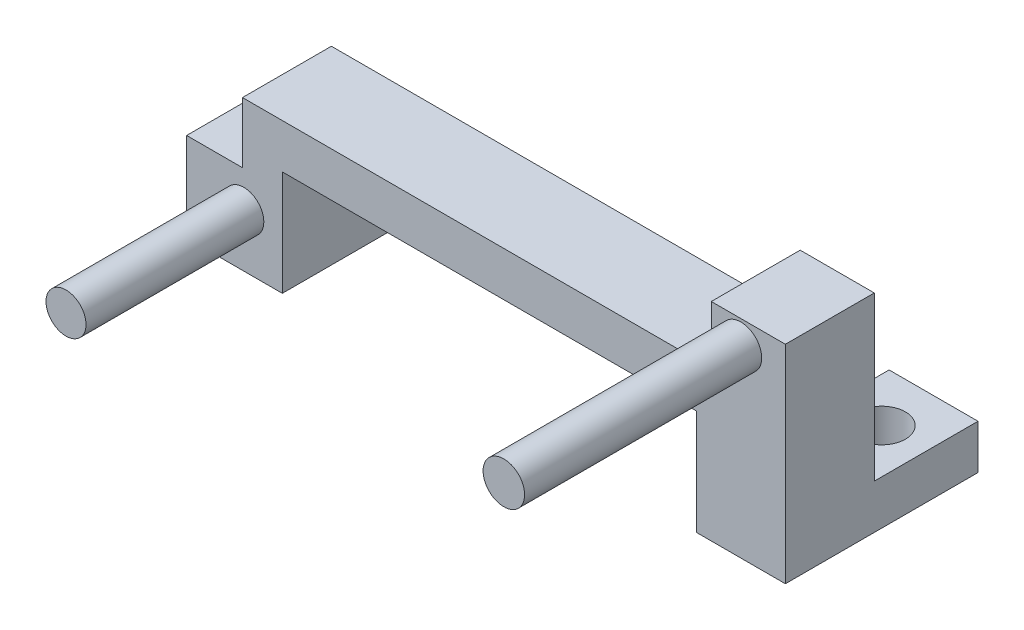
from build123d import *

# Parameters (mm, degrees)
SKETCH1_W            = 4
SKETCH1_H            = 14
BOSS_EXTRUDE1_DEPTH  = 3
SKETCH2_R            = 1.4
BOSS_EXTRUDE2_DEPTH  = 16
SKETCH3_W            = 4
SKETCH3_H            = 1
BOSS_EXTRUDE4_DEPTH  = 6
SKETCH7_W            = 3
SKETCH7_H            = 2
BOSS_EXTRUDE5_DEPTH  = 30.95
SKETCH8_W            = 3
SKETCH8_H            = 2
BOSS_EXTRUDE6_DEPTH  = 1
SKETCH9_W            = 1
SKETCH9_H            = 2
BOSS_EXTRUDE7_DEPTH  = 3
SKETCH10_W           = 1
SKETCH10_H           = 2
BOSS_EXTRUDE8_DEPTH  = 5.92
SKETCH11_W           = 1
SKETCH11_H           = 2
BOSS_EXTRUDE9_DEPTH  = 4
SKETCH12_W           = 1
SKETCH12_H           = 3
BOSS_EXTRUDE14_DEPTH = 0.93
SKETCH13_W           = 3
SKETCH13_H           = 3
BOSS_EXTRUDE15_DEPTH = 7.1
SKETCH14_W           = 3.33402541
SKETCH14_H           = 13.860919233
CUT_EXTRUDE3_DEPTH   = 10
SKETCH15_W           = 6.20666024
SKETCH15_H           = 3.660501205
CUT_EXTRUDE4_DEPTH   = 10
SKETCH16_W           = 3
SKETCH16_H           = 9.1
BOSS_EXTRUDE16_DEPTH = 0.12
SKETCH18_W           = 3
SKETCH18_H           = 9.1
BOSS_EXTRUDE18_DEPTH = 0.41
SKETCH19_W           = 3
SKETCH19_H           = 9.1
BOSS_EXTRUDE19_DEPTH = 0.89
SKETCH20_W           = 3
SKETCH20_H           = 6
BOSS_EXTRUDE20_DEPTH = 3.77
SKETCH21_R           = 1.35
BOSS_EXTRUDE23_DEPTH = 12
BOSS_EXTRUDE24_DEPTH = 3
SKETCH24_W           = 4
SKETCH24_H           = 1
BOSS_EXTRUDE25_DEPTH = 4
SKETCH25_W           = 4
SKETCH25_H           = 7
BOSS_EXTRUDE26_DEPTH = 2
SKETCH26_W           = 6.458993184
SKETCH26_H           = 3
BOSS_EXTRUDE27_DEPTH = 7
SKETCH27_R           = 1.6
CUT_EXTRUDE5_DEPTH   = 7
SKETCH28_R           = 1.6
CUT_EXTRUDE6_DEPTH   = 7
SKETCH30_W           = 7
SKETCH30_H           = 3
BOSS_EXTRUDE29_DEPTH = 1
SKETCH31_W           = 7
SKETCH31_H           = 3
BOSS_EXTRUDE30_DEPTH = 1
SKETCH32_W           = 6
SKETCH32_H           = 7.1
BOSS_EXTRUDE31_DEPTH = 1
SKETCH33_W           = 31.638993184
SKETCH33_H           = 6
BOSS_EXTRUDE32_DEPTH = 1
SKETCH34_W           = 6
SKETCH34_H           = 14
BOSS_EXTRUDE33_DEPTH = 1


with BuildPart() as part:
    # Sketch1 → Boss-Extrude1 (new body)
    with BuildSketch(Plane.XY):
        with Locations((-1.434146341, -3.597560976)):
            Rectangle(SKETCH1_W, SKETCH1_H)
    extrude(amount=BOSS_EXTRUDE1_DEPTH)

    # Sketch2 → Boss-Extrude2 (add)
    with BuildSketch(Plane(origin=(0, 0, 0), x_dir=(-1, 0, 0), z_dir=(0, 0, -1))):
        with Locations(Location((1.434146341, 1.802439024, 0), (0, 0, 180))):
            Circle(SKETCH2_R)
    extrude(amount=BOSS_EXTRUDE2_DEPTH)

    # Sketch3 → Boss-Extrude4 (add)
    with BuildSketch(Plane.XY.offset(3)):
        with Locations((-1.434146341, -10.097560976)):
            Rectangle(SKETCH3_W, SKETCH3_H)
    extrude(amount=BOSS_EXTRUDE4_DEPTH)

    # Sketch7 → Boss-Extrude5 (add)
    with BuildSketch(Plane.ZY.offset(3.434146341)):
        with Locations((1.5, -2.497560976)):
            Rectangle(SKETCH7_W, SKETCH7_H)
    extrude(amount=BOSS_EXTRUDE5_DEPTH)

    # Sketch8 → Boss-Extrude6 (add)
    with BuildSketch(Plane.ZY.offset(34.384146341)):
        with Locations((1.5, -2.497560976)):
            Rectangle(SKETCH8_W, SKETCH8_H)
    extrude(amount=BOSS_EXTRUDE6_DEPTH)

    # Sketch9 → Boss-Extrude7 (add)
    with BuildSketch(Plane(origin=(0, 0, 0), x_dir=(-1, 0, 0), z_dir=(0, 0, -1))):
        with Locations((34.884146341, -2.497560976)):
            Rectangle(SKETCH9_W, SKETCH9_H)
    extrude(amount=BOSS_EXTRUDE7_DEPTH)

    # Sketch10 → Boss-Extrude8 (add)
    with BuildSketch(Plane(origin=(0, 0, -3), x_dir=(-1, 0, 0), z_dir=(0, 0, -1))):
        with Locations((34.884146341, -2.497560976)):
            Rectangle(SKETCH10_W, SKETCH10_H)
    extrude(amount=BOSS_EXTRUDE8_DEPTH)

    # Sketch11 → Boss-Extrude9 (add)
    with BuildSketch(Plane(origin=(0, 0, -8.92), x_dir=(-1, 0, 0), z_dir=(0, 0, -1))):
        with Locations((34.884146341, -2.497560976)):
            Rectangle(SKETCH11_W, SKETCH11_H)
    extrude(amount=BOSS_EXTRUDE9_DEPTH)

    # Sketch12 → Boss-Extrude14 (add)
    with BuildSketch(Plane.XZ.offset(3.497560976)):
        with Locations((-34.884146341, -9.28)):
            Rectangle(SKETCH12_W, SKETCH12_H)
    extrude(amount=BOSS_EXTRUDE14_DEPTH)

    # Sketch13 → Boss-Extrude15 (add)
    with BuildSketch(Plane.XZ.offset(3.497560976)):
        with Locations((-33.884146341, 1.5)):
            Rectangle(SKETCH13_W, SKETCH13_H)
    extrude(amount=BOSS_EXTRUDE15_DEPTH)

    # Sketch14 → Cut-Extrude3 (cut)
    with BuildSketch(Plane.XY.offset(3)):
        with Locations((-35.32015223, -3.66710136)):
            Rectangle(SKETCH14_W, SKETCH14_H)
    extrude(amount=-CUT_EXTRUDE3_DEPTH, mode=Mode.SUBTRACT)


with BuildPart() as cut_extrude3_piece_1:
    # of the separate pieces the step leaves, piece 1, a body of its own (cut_extrude3_pieces)
    add(part.part.solids().sort_by_distance((-3.434146341, 3.402439024, 0))[0])

    # Sketch16 → Boss-Extrude16 (add)
    with BuildSketch(Plane.ZY.offset(33.653139525)):
        with Locations((1.5, -6.047560976)):
            Rectangle(SKETCH16_W, SKETCH16_H)
    extrude(amount=BOSS_EXTRUDE16_DEPTH)

    # Sketch18 → Boss-Extrude18 (add)
    with BuildSketch(Plane.ZY.offset(33.773139525)):
        with Locations((1.5, -6.047560976)):
            Rectangle(SKETCH18_W, SKETCH18_H)
    extrude(amount=BOSS_EXTRUDE18_DEPTH)

    # Sketch19 → Boss-Extrude19 (add)
    with BuildSketch(Plane.ZY.offset(34.183139525)):
        with Locations((1.5, -6.047560976)):
            Rectangle(SKETCH19_W, SKETCH19_H)
    extrude(amount=BOSS_EXTRUDE19_DEPTH)

    # Sketch20 → Boss-Extrude20 (add)
    with BuildSketch(Plane.ZY.offset(35.073139525)):
        with Locations((1.5, -7.597560976)):
            Rectangle(SKETCH20_W, SKETCH20_H)
    extrude(amount=BOSS_EXTRUDE20_DEPTH)

    # Sketch21 → Boss-Extrude23 (add)
    with BuildSketch(Plane(origin=(0, 0, 0), x_dir=(-1, 0, 0), z_dir=(0, 0, -1))):
        with Locations(Location((34.984146341, -7.047560976, 0), (0, 0, 180))):
            Circle(SKETCH21_R)
    extrude(amount=BOSS_EXTRUDE23_DEPTH)

    # Sketch23 → Boss-Extrude24 (add)
    with BuildSketch(Plane.XY.offset(3)):
        Polygon((-38.843139525, -10.597560976), (-38.843139525, -4.597560976), (-35.073139525, -4.597560976), (-35.073139525, -1.497560976), (-3.434146341, -1.497560976), (-3.434146341, 3.402439024), (0.565853659, 3.402439024), (0.565853659, -9.597560976), (-3.434146341, -9.597560976), (-3.434146341, -3.497560976), (-32.384146341, -3.497560976), (-32.384146341, -10.597560976), align=None)
    extrude(amount=BOSS_EXTRUDE24_DEPTH)

    # Sketch24 → Boss-Extrude25 (add)
    with BuildSketch(Plane.XY.offset(9)):
        with Locations((-1.434146341, -10.097560976)):
            Rectangle(SKETCH24_W, SKETCH24_H)
    extrude(amount=BOSS_EXTRUDE25_DEPTH)

    # Sketch25 → Boss-Extrude26 (add)
    with BuildSketch(Plane(origin=(0, -9.597560976, 0), x_dir=(1, 0, 0), z_dir=(0, 1, 0))):
        with Locations((-1.434146341, -9.5)):
            Rectangle(SKETCH25_W, SKETCH25_H)
    extrude(amount=BOSS_EXTRUDE26_DEPTH)

    # Sketch26 → Boss-Extrude27 (add)
    with BuildSketch(Plane.XY.offset(6)):
        with Locations((-35.613642933, -9.097560976)):
            Rectangle(SKETCH26_W, SKETCH26_H)
    extrude(amount=BOSS_EXTRUDE27_DEPTH)

    # Sketch27 → Cut-Extrude5 (cut)
    with BuildSketch(Plane(origin=(0, -7.597560976, 0), x_dir=(1, 0, 0), z_dir=(0, 1, 0))):
        with Locations(Location((-35.613642933, -9.5, 0), (0, 0, 270))):
            Circle(SKETCH27_R)
    extrude(amount=-CUT_EXTRUDE5_DEPTH, mode=Mode.SUBTRACT)

    # Sketch28 → Cut-Extrude6 (cut)
    with BuildSketch(Plane(origin=(0, -7.597560976, 0), x_dir=(1, 0, 0), z_dir=(0, 1, 0))):
        with Locations(Location((-1.434146341, -9.5, 0), (0, 0, 270))):
            Circle(SKETCH28_R)
    extrude(amount=-CUT_EXTRUDE6_DEPTH, mode=Mode.SUBTRACT)

    # Sketch30 → Boss-Extrude29 (add)
    with BuildSketch(Plane(origin=(0.565853659, 0, 0), x_dir=(0, 0, -1), z_dir=(1, 0, 0))):
        with Locations((-9.5, -9.097560976)):
            Rectangle(SKETCH30_W, SKETCH30_H)
    extrude(amount=BOSS_EXTRUDE29_DEPTH)

    # Sketch31 → Boss-Extrude30 (add)
    with BuildSketch(Plane.ZY.offset(3.434146341)):
        with Locations((9.5, -9.097560976)):
            Rectangle(SKETCH31_W, SKETCH31_H)
    extrude(amount=BOSS_EXTRUDE30_DEPTH)

    # Sketch32 → Boss-Extrude31 (add)
    with BuildSketch(Plane.ZY.offset(3.434146341)):
        with Locations((3, -7.047560976)):
            Rectangle(SKETCH32_W, SKETCH32_H)
    extrude(amount=BOSS_EXTRUDE31_DEPTH)

    # Sketch33 → Boss-Extrude32 (add)
    with BuildSketch(Plane(origin=(0, -1.497560976, 0), x_dir=(1, 0, 0), z_dir=(0, 1, 0))):
        with Locations((-19.253642933, -3)):
            Rectangle(SKETCH33_W, SKETCH33_H)
    extrude(amount=BOSS_EXTRUDE32_DEPTH)

    # Sketch34 → Boss-Extrude33 (add)
    with BuildSketch(Plane(origin=(0.565853659, 0, 0), x_dir=(0, 0, -1), z_dir=(1, 0, 0))):
        with Locations((-3, -3.597560976)):
            Rectangle(SKETCH34_W, SKETCH34_H)
    extrude(amount=BOSS_EXTRUDE33_DEPTH)


with BuildPart() as cut_extrude3_piece_2:
    # of the separate pieces the step leaves, piece 2, a body of its own (cut_extrude3_pieces)
    add(part.part.solids().sort_by_distance((-34.384146341, -1.497560976, -7))[0])

    # Sketch15 → Cut-Extrude4 (cut)
    with BuildSketch(Plane.ZY.offset(35.384146341)):
        with Locations((-9.81666988, -3.327811578)):
            Rectangle(SKETCH15_W, SKETCH15_H)
    extrude(amount=-CUT_EXTRUDE4_DEPTH, mode=Mode.SUBTRACT)


with BuildPart() as body_2:
    # Mirror1: mirrored copy
    add(cut_extrude3_piece_1.part.mirror(Plane.XY.offset(-86.517216343)))


solid = body_2.part
